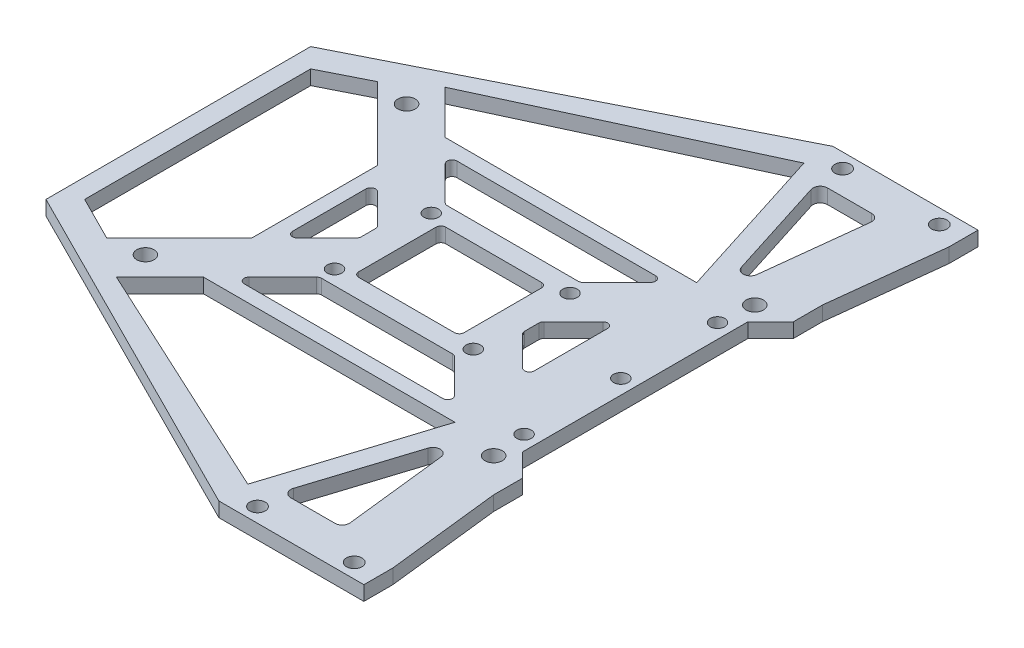
from build123d import *
from build123d.topology import SkipClean

# Parameters (mm, degrees)
SKETCH_1_W          = 86
SKETCH_1_H          = 68
SKETCH_1_R          = 1.8
EXTRUDE_1_DEPTH     = 3
CUT_EXTRUDE_1_DEPTH = 3
SKETCH_3_W          = 30
SKETCH_3_H          = 6
SKETCH_3_R          = 1.6
EXTRUDE_2_DEPTH     = 3
EXTRUDE_3_DEPTH     = 3
SKETCH_5_R          = 1.5
CUT_EXTRUDE_2_DEPTH = 79.276480437
CUT_EXTRUDE_3_DEPTH = 79.276480437
EXTRUDE_4_DEPTH     = 3
EXTRUDE_6_DEPTH     = 3
CUT_EXTRUDE_6_DEPTH = 85.85098703
CUT_EXTRUDE_7_DEPTH = 85.85098703


with BuildPart() as part:
    # 草图1 → 凸台-拉伸1 (new body)
    with BuildSketch(Plane(origin=(0, 0, 0), x_dir=(1, 0, 0), z_dir=(0, 1, 0))):
        Rectangle(SKETCH_1_W, SKETCH_1_H)
        with Locations(Location((-36, -27, 0), (0, 0, 270))):
            Circle(SKETCH_1_R, mode=Mode.SUBTRACT)
        with Locations(Location((-36, 27, 0), (0, 0, 270))):
            Circle(SKETCH_1_R, mode=Mode.SUBTRACT)
        with Locations(Location((36, 27, 0), (0, 0, 270))):
            Circle(SKETCH_1_R, mode=Mode.SUBTRACT)
        with Locations(Location((36, -27, 0), (0, 0, 270))):
            Circle(SKETCH_1_R, mode=Mode.SUBTRACT)
    extrude(amount=EXTRUDE_1_DEPTH)

    # 草图2 → 切除-拉伸1 (cut)
    with BuildSketch(Plane.XZ):
        Polygon((26, 25), (35, 34), (-35, 34), (-26, 25), align=None)
        Polygon((-28, 13), (-43, 28), (-43, -28), (-28, -13), align=None)
        Polygon((-35, -34), (35, -34), (26, -25), (-26, -25), align=None)
        Polygon((43, -28), (43, 28), (28, 13), (28, -13), align=None)
    extrude(amount=-CUT_EXTRUDE_1_DEPTH, mode=Mode.SUBTRACT)

    # 草图3 → 凸台-拉伸2 (add)
    # profile 1 of 3: a face of its own
    with BuildSketch(Plane.XZ):
        Polygon((35, 34), (43, 34), (45.67228251, 57.499999999), (15.67228251, 57.499999999), (26, 25), align=None)
    # profile 2 of 3: a face of its own
    with BuildSketch(Plane.XZ):
        with Locations((30.67228251, 60.499999999)):
            Rectangle(SKETCH_3_W, SKETCH_3_H)
        with Locations(Location((20.67228251, 60.499999999, 0), (0, 0, 270))):
            Circle(SKETCH_3_R, mode=Mode.SUBTRACT)
        with Locations(Location((40.67228251, 60.499999999, 0), (0, 0, 270))):
            Circle(SKETCH_3_R, mode=Mode.SUBTRACT)
    # profile 3 of 3: a face of its own
    with BuildSketch(Plane.XZ):
        Polygon((45.67228251, -63.499999999), (45.67228251, -57.499999999), (43, -34), (35, -34), (26, -25), (15.67228251, -57.499999999), (15.67228251, -63.499999999), align=None)
        with Locations(Location((20.67228251, -60.499999999, 0), (0, 0, 270))):
            Circle(SKETCH_3_R, mode=Mode.SUBTRACT)
        with Locations(Location((40.67228251, -60.499999999, 0), (0, 0, 270))):
            Circle(SKETCH_3_R, mode=Mode.SUBTRACT)
    extrude(amount=-EXTRUDE_2_DEPTH)

    # 草图4 → 凸台-拉伸3 (add)
    with BuildSketch(Plane.XZ):
        Polygon((15.67228251, 57.499999999), (15.67228251, 63.499999999), (-43, 34), (-35, 34), align=None)
        Polygon((-35, -34), (-43, -34), (15.67228251, -63.499999999), (15.67228251, -57.499999999), align=None)
    extrude(amount=-EXTRUDE_3_DEPTH)

    # 草图5 → 切除-拉伸2 (cut, through all)
    with BuildSketch(Plane.XZ):
        with Locations(Location((-13.9, 10, 0), (0, 0, 270))):
            Circle(SKETCH_5_R)
        with Locations(Location((14.8, 10, 0), (0, 0, 270))):
            Circle(SKETCH_5_R)
        with Locations(Location((-13.9, -10, 0), (0, 0, 270))):
            Circle(SKETCH_5_R)
        with Locations(Location((14.8, -10, 0), (0, 0, 270))):
            Circle(SKETCH_5_R)
    extrude(amount=-CUT_EXTRUDE_2_DEPTH, mode=Mode.SUBTRACT)

    # 草图6 → 切除-拉伸3 (cut, through all)
    with BuildSketch(Plane.XZ):
        with BuildLine():
            Line((-21.292893219, 20.292893219), (-14.292893219, 13.292893219))
            ThreePointArc((-14.292893219, 13.292893219), (-13.96846987, 13.076120467), (-13.585786438, 13))
            Line((-13.585786438, 13), (13.485786438, 13))
            ThreePointArc((13.485786438, 13), (13.86846987, 13.076120467), (14.192893219, 13.292893219))
            Line((14.192893219, 13.292893219), (21.192893219, 20.292893219))
            ThreePointArc((21.192893219, 20.292893219), (21.40966597, 21.382683432), (20.485786438, 22))
            Line((20.485786438, 22), (-20.585786438, 22))
            ThreePointArc((-20.585786438, 22), (-21.50966597, 21.382683432), (-21.292893219, 20.292893219))
        make_face()
        with BuildLine():
            Line((-25, 7.585786438), (-25, -7.585786438))
            ThreePointArc((-25, -7.585786438), (-24.382683432, -8.50966597), (-23.292893219, -8.292893219))
            Line((-23.292893219, -8.292893219), (-17.192893219, -2.192893219))
            ThreePointArc((-17.192893219, -2.192893219), (-16.976120467, -1.86846987), (-16.9, -1.485786438))
            Line((-16.9, -1.485786438), (-16.9, 1.485786438))
            ThreePointArc((-16.9, 1.485786438), (-16.976120467, 1.86846987), (-17.192893219, 2.192893219))
            Line((-17.192893219, 2.192893219), (-23.292893219, 8.292893219))
            ThreePointArc((-23.292893219, 8.292893219), (-24.382683432, 8.50966597), (-25, 7.585786438))
        make_face()
        with BuildLine():
            Line((-9.9, 9), (9.9, 9))
            ThreePointArc((9.9, 9), (10.607106781, 8.707106781), (10.9, 8))
            Line((10.9, 8), (10.9, -8))
            ThreePointArc((10.9, -8), (10.607106781, -8.707106781), (9.9, -9))
            Line((9.9, -9), (-9.9, -9))
            ThreePointArc((-9.9, -9), (-10.607106781, -8.707106781), (-10.9, -8))
            Line((-10.9, -8), (-10.9, 8))
            ThreePointArc((-10.9, 8), (-10.607106781, 8.707106781), (-9.9, 9))
        make_face()
        with BuildLine():
            Line((14.192893219, -13.292893219), (21.192893219, -20.292893219))
            ThreePointArc((21.192893219, -20.292893219), (21.40966597, -21.382683432), (20.485786438, -22))
            Line((20.485786438, -22), (-20.585786438, -22))
            ThreePointArc((-20.585786438, -22), (-21.50966597, -21.382683432), (-21.292893219, -20.292893219))
            Line((-21.292893219, -20.292893219), (-14.292893219, -13.292893219))
            ThreePointArc((-14.292893219, -13.292893219), (-13.96846987, -13.076120467), (-13.585786438, -13))
            Line((-13.585786438, -13), (13.485786438, -13))
            ThreePointArc((13.485786438, -13), (13.86846987, -13.076120467), (14.192893219, -13.292893219))
        make_face()
        with BuildLine():
            Line((16.9, -1.485786438), (16.9, 1.485786438))
            ThreePointArc((16.9, 1.485786438), (16.976120467, 1.86846987), (17.192893219, 2.192893219))
            Line((17.192893219, 2.192893219), (23.292893219, 8.292893219))
            ThreePointArc((23.292893219, 8.292893219), (24.382683432, 8.50966597), (25, 7.585786438))
            Line((25, 7.585786438), (25, -7.585786438))
            ThreePointArc((25, -7.585786438), (24.382683432, -8.50966597), (23.292893219, -8.292893219))
            Line((23.292893219, -8.292893219), (17.192893219, -2.192893219))
            ThreePointArc((17.192893219, -2.192893219), (16.976120467, -1.86846987), (16.9, -1.485786438))
        make_face()
    extrude(amount=-CUT_EXTRUDE_3_DEPTH, mode=Mode.SUBTRACT)

    # 草图7 → 凸台-拉伸4 (add)
    with BuildSketch(Plane.XZ):
        Polygon((-56.2, 27.363135311), (-56.2, -27.363135311), (-43, -34), (-43, -28), (-52.2, -23.374306429), (-52.2, 23.374306429), (-43, 28), (-43, 34), align=None)
    extrude(amount=-EXTRUDE_4_DEPTH)

    # 草图11 → 凸台-拉伸6 (add)
    with BuildSketch(Plane.XZ):
        with BuildLine():
            Line((35.3, 1.5), (35.3, 18.5))
            ThreePointArc((35.3, 18.5), (34.629179607, 18.658359214), (34.1, 19.1))
            Line((34.1, 19.1), (28, 13))
            Line((28, 13), (28, -13))
            Line((28, -13), (34.1, -19.1))
            ThreePointArc((34.1, -19.1), (34.629179607, -18.658359214), (35.3, -18.5))
            Line((35.3, -18.5), (35.3, -1.5))
            ThreePointArc((35.3, -1.5), (33.8, 0), (35.3, 1.5))
        make_face()
        with BuildLine():
            ThreePointArc((36.8, 20), (36.360660172, 18.939339828), (35.3, 18.5))
            Line((35.3, 18.5), (35.3, 1.5))
            ThreePointArc((35.3, 1.5), (36.360660172, 1.060660172), (36.8, 0))
            ThreePointArc((36.8, 0), (36.360660172, -1.060660172), (35.3, -1.5))
            Line((35.3, -1.5), (35.3, -18.5))
            ThreePointArc((35.3, -18.5), (36.360660172, -18.939339828), (36.8, -20))
            ThreePointArc((36.8, -20), (36.641640786, -20.670820393), (36.2, -21.2))
            Line((36.2, -21.2), (38.3, -23.3))
            Line((38.3, -23.3), (38.3, 23.3))
            Line((38.3, 23.3), (36.2, 21.2))
            ThreePointArc((36.2, 21.2), (36.641640786, 20.670820393), (36.8, 20))
        make_face()
    extrude(amount=-EXTRUDE_6_DEPTH)

    # 草图11<3> → 切除-拉伸6 (cut, through all)
    with SkipClean():  # the faces are left unmerged after this step: merging them gives an invalid solid
        with BuildSketch(Plane.XZ):
            with BuildLine():
                ThreePointArc((36.2, 21.2), (34.239339828, 21.060660172), (34.1, 19.1))
                Line((34.1, 19.1), (36.2, 21.2))
            make_face()
            with BuildLine():
                Line((36.2, 21.2), (34.1, 19.1))
                ThreePointArc((34.1, 19.1), (35.774341649, 18.576975053), (36.8, 20))
                ThreePointArc((36.8, 20), (36.641640786, 20.670820393), (36.2, 21.2))
            make_face()
            with BuildLine():
                ThreePointArc((36.8, -20), (35.774341649, -18.576975053), (34.1, -19.1))
                Line((34.1, -19.1), (36.2, -21.2))
                ThreePointArc((36.2, -21.2), (36.641640786, -20.670820393), (36.8, -20))
            make_face()
            with BuildLine():
                Line((36.2, -21.2), (34.1, -19.1))
                ThreePointArc((34.1, -19.1), (34.239339828, -21.060660172), (36.2, -21.2))
            make_face()
        extrude(amount=-CUT_EXTRUDE_6_DEPTH, mode=Mode.SUBTRACT)

    # 草图12 → 切除-拉伸7 (cut, through all)
    with SkipClean():  # the faces are left unmerged after this step: merging them gives an invalid solid
        with BuildSketch(Plane.XZ):
            with BuildLine():
                Line((21.125963718, 53.545721451), (27.85115527, 32.382407713))
                ThreePointArc((27.85115527, 32.382407713), (29.426324108, 31.343770669), (30.771106367, 32.667207276))
                Line((30.771106367, 32.667207276), (33.177674586, 53.830521014))
                ThreePointArc((33.177674586, 53.830521014), (32.806256586, 54.998944823), (31.687279714, 55.499999999))
                Line((31.687279714, 55.499999999), (22.555519943, 55.499999999))
                ThreePointArc((22.555519943, 55.499999999), (21.344855286, 54.885602104), (21.125963718, 53.545721451))
            make_face()
            with BuildLine():
                Line((30.771106367, -32.667207276), (33.177674586, -53.830521014))
                ThreePointArc((33.177674586, -53.830521014), (32.806256586, -54.998944823), (31.687279714, -55.499999999))
                Line((31.687279714, -55.499999999), (22.555519943, -55.499999999))
                ThreePointArc((22.555519943, -55.499999999), (21.344855286, -54.885602104), (21.125963718, -53.545721451))
                Line((21.125963718, -53.545721451), (27.85115527, -32.382407713))
                ThreePointArc((27.85115527, -32.382407713), (29.426324108, -31.343770669), (30.771106367, -32.667207276))
            make_face()
        extrude(amount=-CUT_EXTRUDE_7_DEPTH, mode=Mode.SUBTRACT)


solid = part.part
